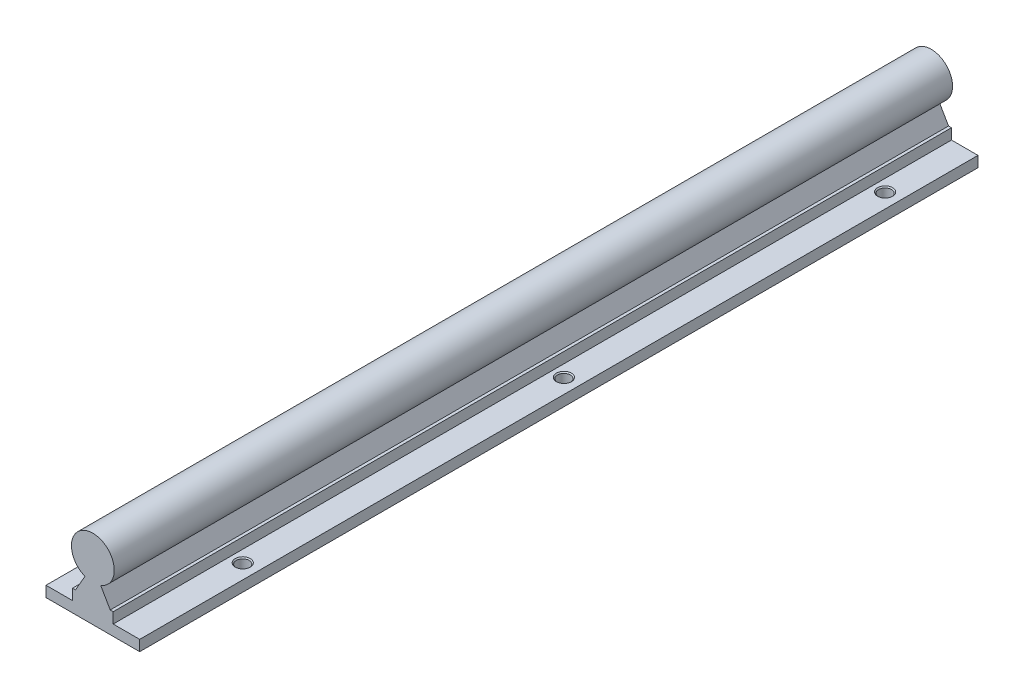
from build123d import *

# Parameters (mm, degrees)
SALIENTE_EXTRUIR1_DEPTH = 205
CORTAR_EXTRUIR1_REACH   = 211.458
CROQUIS2_R              = 3
CHAFL_N1_SIZE           = 0.5
CROQUIS3_W              = 43.76
CROQUIS3_H              = 18.5
CORTAR_EXTRUIR2_DEPTH   = 210.458192487


with BuildPart() as part:
    # Croquis1 → Saliente-Extruir1 (new, symmetric)
    with BuildSketch(Plane.XY):
        with BuildLine():
            Line((-8.121192263, 10), (-3.67559519, 17.7))
            ThreePointArc((-3.67559519, 17.7), (0, 37), (3.67559519, 17.7))
            Line((3.67559519, 17.7), (8.121192263, 10))
            Line((8.121192263, 10), (9.5, 10))
            Line((9.5, 10), (9.5, 5))
            Line((9.5, 5), (21.88, 5))
            Line((21.88, 5), (21.88, 0))
            Line((21.88, 0), (-21.88, 0))
            Line((-21.88, 0), (-21.88, 5))
            Line((-21.88, 5), (-9.5, 5))
            Line((-9.5, 5), (-9.5, 10))
            Line((-9.5, 10), (-8.121192263, 10))
        make_face()
    extrude(amount=SALIENTE_EXTRUIR1_DEPTH, both=True)

    # Croquis2 → Cortar-Extruir1 (cut, up to next)
    with BuildSketch(Plane.XZ, mode=Mode.PRIVATE) as cortar_extruir1_sk1:
        with Locations(Location((15, 150, 0), (0, 0, 270))):
            Circle(CROQUIS2_R)
    cortar_extruir1_tool1 = extrude(cortar_extruir1_sk1.sketch, amount=-CORTAR_EXTRUIR1_REACH, mode=Mode.PRIVATE) & part.part
    # Croquis2 → Cortar-Extruir1 (cut, up to next)
    with BuildSketch(Plane.XZ, mode=Mode.PRIVATE) as cortar_extruir1_sk2:
        with Locations(Location((-15, 150, 0), (0, 0, 270))):
            Circle(CROQUIS2_R)
    cortar_extruir1_tool2 = extrude(cortar_extruir1_sk2.sketch, amount=-CORTAR_EXTRUIR1_REACH, mode=Mode.PRIVATE) & part.part
    # Croquis2 → Cortar-Extruir1 (cut, up to next)
    with BuildSketch(Plane.XZ, mode=Mode.PRIVATE) as cortar_extruir1_sk3:
        with Locations(Location((-15, 0, 0), (0, 0, 270))):
            Circle(CROQUIS2_R)
    cortar_extruir1_tool3 = extrude(cortar_extruir1_sk3.sketch, amount=-CORTAR_EXTRUIR1_REACH, mode=Mode.PRIVATE) & part.part
    # Croquis2 → Cortar-Extruir1 (cut, up to next)
    with BuildSketch(Plane.XZ, mode=Mode.PRIVATE) as cortar_extruir1_sk4:
        with Locations(Location((15, 0, 0), (0, 0, 270))):
            Circle(CROQUIS2_R)
    cortar_extruir1_tool4 = extrude(cortar_extruir1_sk4.sketch, amount=-CORTAR_EXTRUIR1_REACH, mode=Mode.PRIVATE) & part.part
    # Croquis2 → Cortar-Extruir1 (cut, up to next)
    with BuildSketch(Plane.XZ, mode=Mode.PRIVATE) as cortar_extruir1_sk5:
        with Locations(Location((15, -150, 0), (0, 0, 270))):
            Circle(CROQUIS2_R)
    cortar_extruir1_tool5 = extrude(cortar_extruir1_sk5.sketch, amount=-CORTAR_EXTRUIR1_REACH, mode=Mode.PRIVATE) & part.part
    # Croquis2 → Cortar-Extruir1 (cut, up to next)
    with BuildSketch(Plane.XZ, mode=Mode.PRIVATE) as cortar_extruir1_sk6:
        with Locations(Location((-15, -150, 0), (0, 0, 270))):
            Circle(CROQUIS2_R)
    cortar_extruir1_tool6 = extrude(cortar_extruir1_sk6.sketch, amount=-CORTAR_EXTRUIR1_REACH, mode=Mode.PRIVATE) & part.part
    add(cortar_extruir1_tool1.solids().sort_by_distance((15, 0, 150))[0], mode=Mode.SUBTRACT)
    add(cortar_extruir1_tool2.solids().sort_by_distance((-15, 0, 150))[0], mode=Mode.SUBTRACT)
    add(cortar_extruir1_tool3.solids().sort_by_distance((-15, 0, 0))[0], mode=Mode.SUBTRACT)
    add(cortar_extruir1_tool4.solids().sort_by_distance((15, 0, 0))[0], mode=Mode.SUBTRACT)
    add(cortar_extruir1_tool5.solids().sort_by_distance((15, 0, -150))[0], mode=Mode.SUBTRACT)
    add(cortar_extruir1_tool6.solids().sort_by_distance((-15, 0, -150))[0], mode=Mode.SUBTRACT)

    # Chaflán1
    chafl_n1_edges = [part.edges().sort_by_distance(p)[0] for p in [
        (-15, 5, 153),
        (-15, 5, 3),
        (15, 5, 3),
        (15, 5, -147),
        (-15, 5, -147),
        (15, 5, 153),
    ]]
    chamfer(chafl_n1_edges, length=CHAFL_N1_SIZE)

    # Croquis3 → Cortar-Extruir2 (cut, through all)
    with BuildSketch(Plane.XZ):
        with Locations((0, -195.75)):
            Rectangle(CROQUIS3_W, CROQUIS3_H)
    extrude(amount=-CORTAR_EXTRUIR2_DEPTH, mode=Mode.SUBTRACT)


solid = part.part
